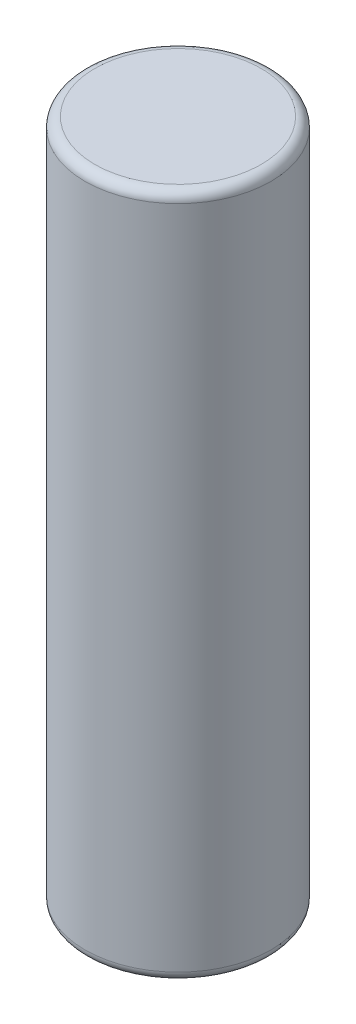
from build123d import *

# Parameters (mm, degrees)
SKETCH_1_R      = 9.5
EXTRUDE_1_DEPTH = 70
FILLET_1_R      = 1


with BuildPart() as part:
    # 草图1 → 凸台-拉伸1 (new body)
    with BuildSketch(Plane(origin=(0, 0, 0), x_dir=(1, 0, 0), z_dir=(0, 1, 0))):
        with Locations(Location((0, 0, 0), (0, 0, 270))):
            Circle(SKETCH_1_R)
    extrude(amount=EXTRUDE_1_DEPTH)

    # 圆角1
    fillet_1_edges = [part.edges().sort_by_distance(p)[0] for p in [
        (0, 0, -9.5),
        (0, 70, -9.5),
    ]]
    fillet(fillet_1_edges, radius=FILLET_1_R)


solid = part.part
